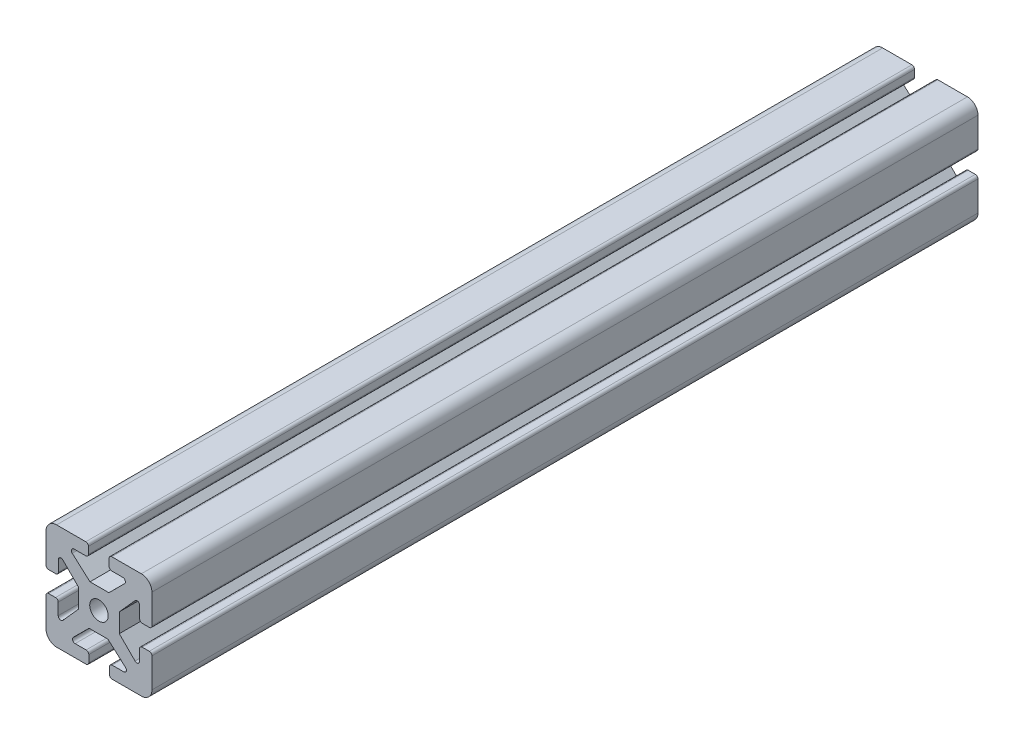
from build123d import *

# Parameters (mm, degrees)
SKETCH2_R           = 3.492543695
BOSS_EXTRUDE1_DEPTH = 312


with BuildPart() as part:
    # Sketch2 → Boss-Extrude1 (new body)
    with BuildSketch(Plane.XY):
        with BuildLine():
            Line((19.48831917, 27.684671829), (23.749889801, 27.684671829))
            Line((23.749889801, 27.684671829), (29.699681879, 33.624984685))
            ThreePointArc((29.699681879, 33.624984685), (29.917171057, 34.714970099), (28.993139054, 35.332654972))
            Line((28.993139054, 35.332654972), (24.845630957, 35.332654972))
            ThreePointArc((24.845630957, 35.332654972), (24.138524175, 35.625548191), (23.845630957, 36.332654972))
            Line((23.845630957, 36.332654972), (23.845630957, 39))
            ThreePointArc((23.845630957, 39), (24.138524175, 39.707106781), (24.845630957, 40))
            Line((24.845630957, 40), (36, 40))
            ThreePointArc((36, 40), (38.828427125, 38.828427125), (40, 36))
            Line((40, 36), (40, 24.961087436))
            ThreePointArc((40, 24.961087436), (39.707106781, 24.253980655), (39, 23.961087436))
            Line((39, 23.961087436), (36.388269628, 23.961087436))
            ThreePointArc((36.388269628, 23.961087436), (35.681162846, 24.253980655), (35.388269628, 24.961087436))
            Line((35.388269628, 24.961087436), (35.388269628, 29.408620307))
            ThreePointArc((35.388269628, 29.408620307), (34.744223919, 30.343123673), (33.641676542, 30.073901274))
            Line((33.641676542, 30.073901274), (27.684671829, 23.388818206))
            Line((27.684671829, 23.388818206), (27.684671829, 20.51168083))
            Line((27.684671829, 20.51168083), (27.684671829, 16.250110199))
            Line((27.684671829, 16.250110199), (33.624984685, 10.300318121))
            ThreePointArc((33.624984685, 10.300318121), (34.714970099, 10.082828943), (35.332654972, 11.006860946))
            Line((35.332654972, 11.006860946), (35.332654972, 15.154369043))
            ThreePointArc((35.332654972, 15.154369043), (35.625548191, 15.861475825), (36.332654972, 16.154369043))
            Line((36.332654972, 16.154369043), (39, 16.154369043))
            ThreePointArc((39, 16.154369043), (39.707106781, 15.861475825), (40, 15.154369043))
            Line((40, 15.154369043), (40, 4))
            ThreePointArc((40, 4), (38.828427125, 1.171572875), (36, 0))
            Line((36, 0), (24.961087436, 0))
            ThreePointArc((24.961087436, 0), (24.253980655, 0.292893219), (23.961087436, 1))
            Line((23.961087436, 1), (23.961087436, 3.611730372))
            ThreePointArc((23.961087436, 3.611730372), (24.253980655, 4.318837154), (24.961087436, 4.611730372))
            Line((24.961087436, 4.611730372), (29.408620307, 4.611730372))
            ThreePointArc((29.408620307, 4.611730372), (30.343123673, 5.255776081), (30.073901274, 6.358323458))
            Line((30.073901274, 6.358323458), (23.388818206, 12.315328171))
            Line((23.388818206, 12.315328171), (20.51168083, 12.315328171))
            Line((20.51168083, 12.315328171), (16.250110199, 12.315328171))
            Line((16.250110199, 12.315328171), (10.300318121, 6.375015315))
            ThreePointArc((10.300318121, 6.375015315), (10.082828943, 5.285029901), (11.006860946, 4.667345028))
            Line((11.006860946, 4.667345028), (15.154369043, 4.667345028))
            ThreePointArc((15.154369043, 4.667345028), (15.861475825, 4.374451809), (16.154369043, 3.667345028))
            Line((16.154369043, 3.667345028), (16.154369043, 1))
            ThreePointArc((16.154369043, 1), (15.861475825, 0.292893219), (15.154369043, 0))
            Line((15.154369043, 0), (4, 0))
            ThreePointArc((4, 0), (1.171572875, 1.171572875), (0, 4))
            Line((0, 4), (0, 15.038912564))
            ThreePointArc((0, 15.038912564), (0.292893219, 15.746019345), (1, 16.038912564))
            Line((1, 16.038912564), (3.611730372, 16.038912564))
            ThreePointArc((3.611730372, 16.038912564), (4.318837154, 15.746019345), (4.611730372, 15.038912564))
            Line((4.611730372, 15.038912564), (4.611730372, 10.591379693))
            ThreePointArc((4.611730372, 10.591379693), (5.255776081, 9.656876327), (6.358323458, 9.926098726))
            Line((6.358323458, 9.926098726), (12.315328171, 16.611181794))
            Line((12.315328171, 16.611181794), (12.315328171, 19.48831917))
            Line((12.315328171, 19.48831917), (12.315328171, 23.749889801))
            Line((12.315328171, 23.749889801), (6.375015315, 29.699681879))
            ThreePointArc((6.375015315, 29.699681879), (5.285029901, 29.917171057), (4.667345028, 28.993139054))
            Line((4.667345028, 28.993139054), (4.667345028, 24.845630957))
            ThreePointArc((4.667345028, 24.845630957), (4.374451809, 24.138524175), (3.667345028, 23.845630957))
            Line((3.667345028, 23.845630957), (1, 23.845630957))
            ThreePointArc((1, 23.845630957), (0.292893219, 24.138524175), (0, 24.845630957))
            Line((0, 24.845630957), (0, 36))
            ThreePointArc((0, 36), (1.171572875, 38.828427125), (4, 40))
            Line((4, 40), (15.038912564, 40))
            ThreePointArc((15.038912564, 40), (15.746019345, 39.707106781), (16.038912564, 39))
            Line((16.038912564, 39), (16.038912564, 36.388269628))
            ThreePointArc((16.038912564, 36.388269628), (15.746019345, 35.681162846), (15.038912564, 35.388269628))
            Line((15.038912564, 35.388269628), (10.591379693, 35.388269628))
            ThreePointArc((10.591379693, 35.388269628), (9.656876327, 34.744223919), (9.926098726, 33.641676542))
            Line((9.926098726, 33.641676542), (16.611181794, 27.684671829))
            Line((16.611181794, 27.684671829), (19.48831917, 27.684671829))
        make_face()
        with Locations((20, 20)):
            Circle(SKETCH2_R, mode=Mode.SUBTRACT)
    extrude(amount=BOSS_EXTRUDE1_DEPTH)


solid = part.part
